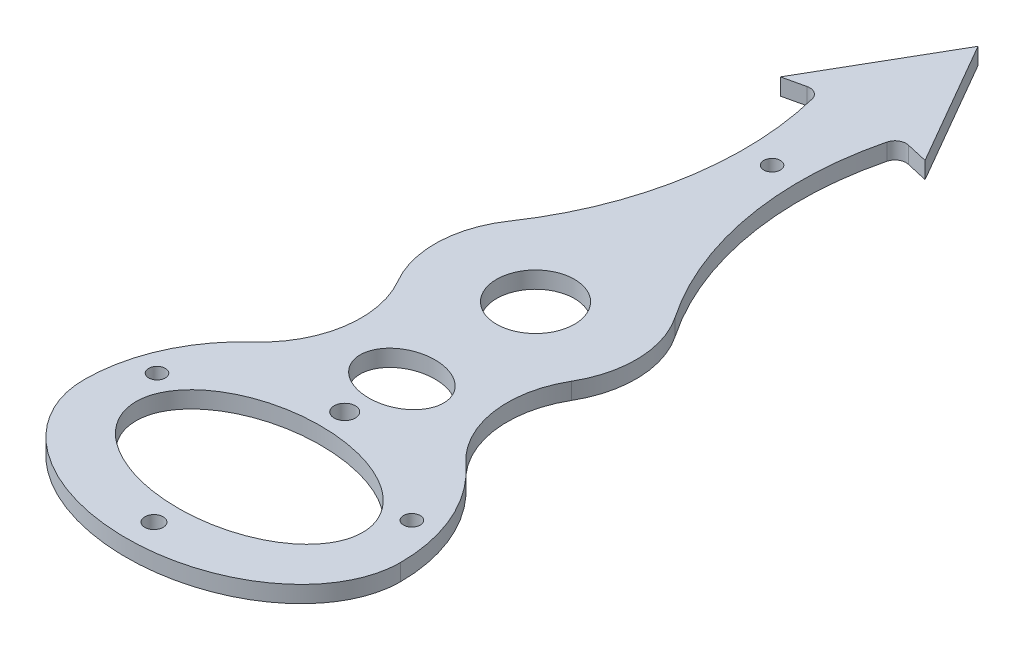
from build123d import *

# Parameters (mm, degrees)
SKETCH1_R           = 1.65
SKETCH1_R_2         = 1.5
SKETCH1_R_3         = 7
SKETCH1_R_4         = 1.909188309
BOSS_EXTRUDE1_DEPTH = 3
SKETCH2_RX          = 20.362751378
SKETCH2_RY          = 12.812950259
SKETCH2_RX_2        = 7.5
SKETCH2_RY_2        = 5.944828068
CUT_EXTRUDE1_DEPTH  = 85.488395158


with BuildPart() as part:
    # Sketch1 → Boss-Extrude1 (new body)
    with BuildSketch(Plane(origin=(0, 0, 0), x_dir=(1, 0, 0), z_dir=(0, 1, 0))):
        with BuildLine():
            Line((-12.992809169, 56.995794387), (0, 79.5))
            Line((0, 79.5), (12.992809169, 56.995794387))
            Line((12.992809169, 56.995794387), (9.092858534, 57.88483041))
            ThreePointArc((9.092858534, 57.88483041), (7.600788158, 57.638566935), (6.707634818, 56.418240413))
            ThreePointArc((6.707634818, 56.418240413), (5.891310086, 32.40341367), (14.944034973, 10.145236258))
            ThreePointArc((14.944034973, 10.145236258), (18.051873862, 0.616319792), (15.601179111, -9.102373886))
            ThreePointArc((15.601179111, -9.102373886), (13.352587893, -20.968024673), (19.083723838, -31.598354482))
            ThreePointArc((19.083723838, -31.598354482), (25.998546823, -41.152307046), (28.443609023, -52.689830928))
            add(Edge.make_bspline(
                [(-28.443609023, -52.689830928), (-28.443609023, -73.556390977), (0, -73.556390977), (28.443609023, -73.556390977), (28.443609023, -52.689830928)],
                knots=[0, 0, 0, 1.570796327, 1.570796327, 3.141592654, 3.141592654, 3.141592654], degree=2, weights=[1, 0.707106781, 1, 0.707106781, 1]))
            ThreePointArc((-28.443609023, -52.689830928), (-25.998546823, -41.152307046), (-19.083723838, -31.598354482))
            ThreePointArc((-19.083723838, -31.598354482), (-13.352587893, -20.968024673), (-15.601179111, -9.102373886))
            ThreePointArc((-15.601179111, -9.102373886), (-18.051873862, 0.616319792), (-14.944034973, 10.145236258))
            ThreePointArc((-14.944034973, 10.145236258), (-5.891310086, 32.40341367), (-6.707634818, 56.418240413))
            ThreePointArc((-6.707634818, 56.418240413), (-7.600788158, 57.638566935), (-9.092858534, 57.88483041))
            Line((-9.092858534, 57.88483041), (-12.992809169, 56.995794387))
        make_face()
        with Locations(Location((0, -68.556390977, 0), (0, 0, 270))):
            Circle(SKETCH1_R, mode=Mode.SUBTRACT)
        with Locations(Location((-22.896149501, -45.11234526, 0), (0, 0, 270))):
            Circle(SKETCH1_R_2, mode=Mode.SUBTRACT)
        with Locations(Location((22.896149501, -45.11234526, 0), (0, 0, 90))):
            Circle(SKETCH1_R_2, mode=Mode.SUBTRACT)
        with Locations(Location((0, 0, 0), (0, 0, 270))):
            Circle(SKETCH1_R_3, mode=Mode.SUBTRACT)
        with Locations(Location((0, 42.497076519, 0), (0, 0, 270))):
            Circle(SKETCH1_R_2, mode=Mode.SUBTRACT)
        with Locations(Location((0, -34.278195489, 0), (0, 0, 270))):
            Circle(SKETCH1_R_4, mode=Mode.SUBTRACT)
    extrude(amount=BOSS_EXTRUDE1_DEPTH)

    # Sketch2 → Cut-Extrude1 (cut, through all)
    with BuildSketch(Plane(origin=(0, 3, 0), x_dir=(1, 0, 0), z_dir=(0, 1, 0))):
        with Locations((0, -51.417293233)):
            Ellipse(SKETCH2_RX, SKETCH2_RY)
        with Locations(Location((0, -24.007219936), (0, 0, -180))):
            Ellipse(SKETCH2_RX_2, SKETCH2_RY_2)
    extrude(amount=-CUT_EXTRUDE1_DEPTH, mode=Mode.SUBTRACT)


solid = part.part
